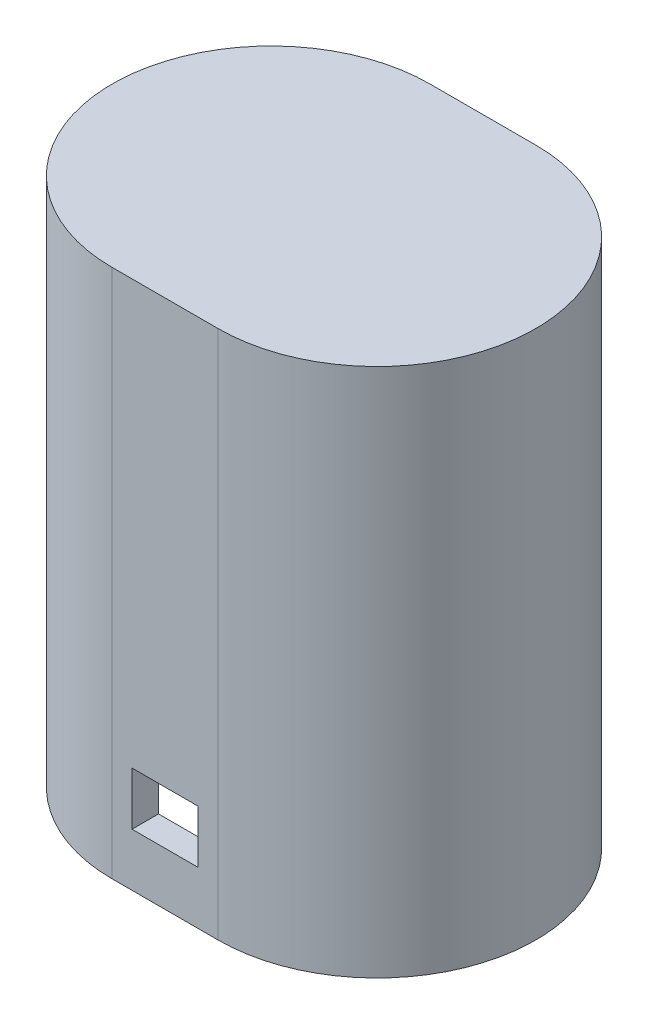
from build123d import *

# Parameters (mm, degrees)
BOSS_EXTRUDE1_DEPTH     = 20
SHELL1_T                = -1
CUT_EXTRUDE1_DEPTH      = 25.657656012
CUT_EXTRUDE1_DEPTH_BACK = 25.657656012
SKETCH2_W               = 2.5
SKETCH2_H               = 2


with BuildPart() as part:
    # Sketch1 → Boss-Extrude1 (new body)
    with BuildSketch(Plane(origin=(0, 0, 0), x_dir=(1, 0, 0), z_dir=(0, 1, 0))):
        with BuildLine():
            Line((-2, -6), (2, -6))
            ThreePointArc((2, -6), (8, 0), (2, 6))
            Line((2, 6), (-2, 6))
            ThreePointArc((-2, 6), (-8, 0), (-2, -6))
        make_face()
    extrude(amount=BOSS_EXTRUDE1_DEPTH)

    # Shell1
    shell1_openings = [part.faces().sort_by_distance(p)[0] for p in [
        (0, 0, 0),
    ]]
    offset(amount=SHELL1_T, openings=shell1_openings, kind=Kind.INTERSECTION)

    # Sketch2 → Cut-Extrude1 (cut, two sides: drawn at the far end of the back side and taken through both)
    with BuildSketch(Plane.XY.offset(6).offset(-CUT_EXTRUDE1_DEPTH_BACK)):
        with Locations((0, 3)):
            Rectangle(SKETCH2_W, SKETCH2_H)
    extrude(amount=CUT_EXTRUDE1_DEPTH + CUT_EXTRUDE1_DEPTH_BACK, mode=Mode.SUBTRACT)


solid = part.part
